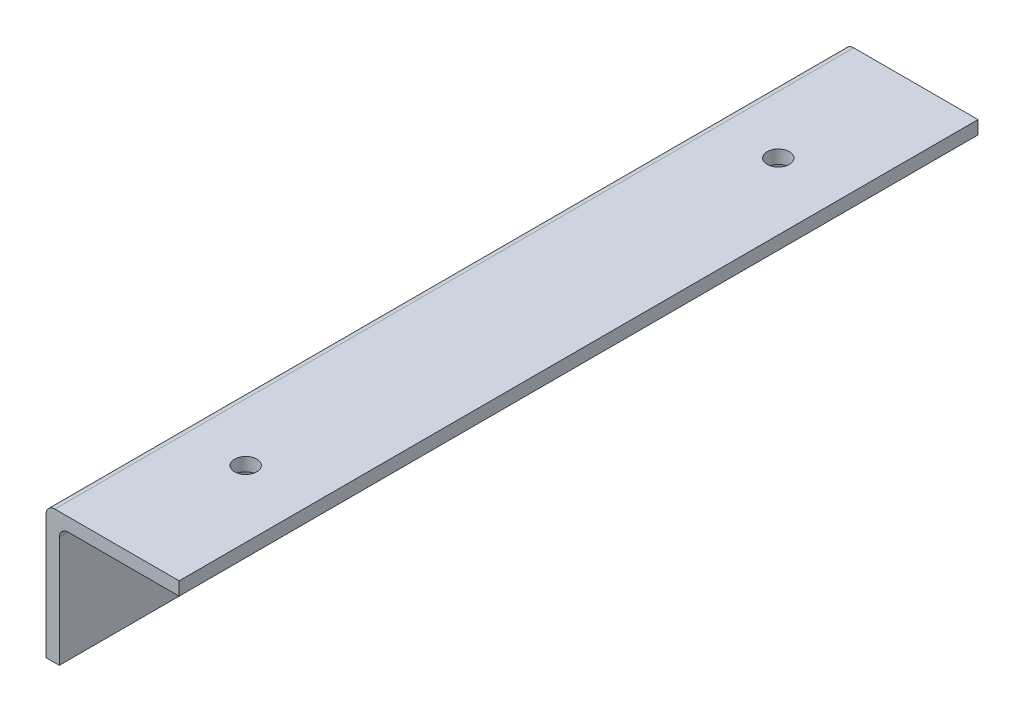
from build123d import *

# Parameters (mm, degrees)
BOSS_EXTRU_1_DEPTH      = 180
ESQUISSE2_R             = 3
ENL_V_MAT_EXTRU_1_DEPTH = 180
ESQUISSE3_R             = 2.5
ENL_V_MAT_EXTRU_2_DEPTH = 180
CONG_1_R                = 2


with BuildPart() as part:
    # Esquisse1 → Boss.-Extru.1 (new body)
    with BuildSketch(Plane.XY):
        Polygon((0, 0), (0, -30), (3, -30), (3, -3), (30, -3), (30, 0), align=None)
    extrude(amount=BOSS_EXTRU_1_DEPTH)

    # Esquisse2 → Enlèv. mat.-Extru.1 (cut)
    with BuildSketch(Plane(origin=(3, 0, 0), x_dir=(0, 0, -1), z_dir=(1, 0, 0))):
        with Locations((-30, -15)):
            Circle(ESQUISSE2_R)
        with Locations((-150, -15)):
            Circle(ESQUISSE2_R)
    extrude(amount=-ENL_V_MAT_EXTRU_1_DEPTH, mode=Mode.SUBTRACT)

    # Esquisse3 → Enlèv. mat.-Extru.2 (cut)
    with BuildSketch(Plane.XZ.offset(3)):
        with Locations((15, 150)):
            Circle(ESQUISSE3_R)
        with Locations((15, 30)):
            Circle(ESQUISSE3_R)
    extrude(amount=-ENL_V_MAT_EXTRU_2_DEPTH, mode=Mode.SUBTRACT)

    # Congé1
    cong_1_edges = [part.edges().sort_by_distance(p)[0] for p in [
        (3, -3, 90),
        (0, 0, 90),
    ]]
    fillet(cong_1_edges, radius=CONG_1_R)


solid = part.part
